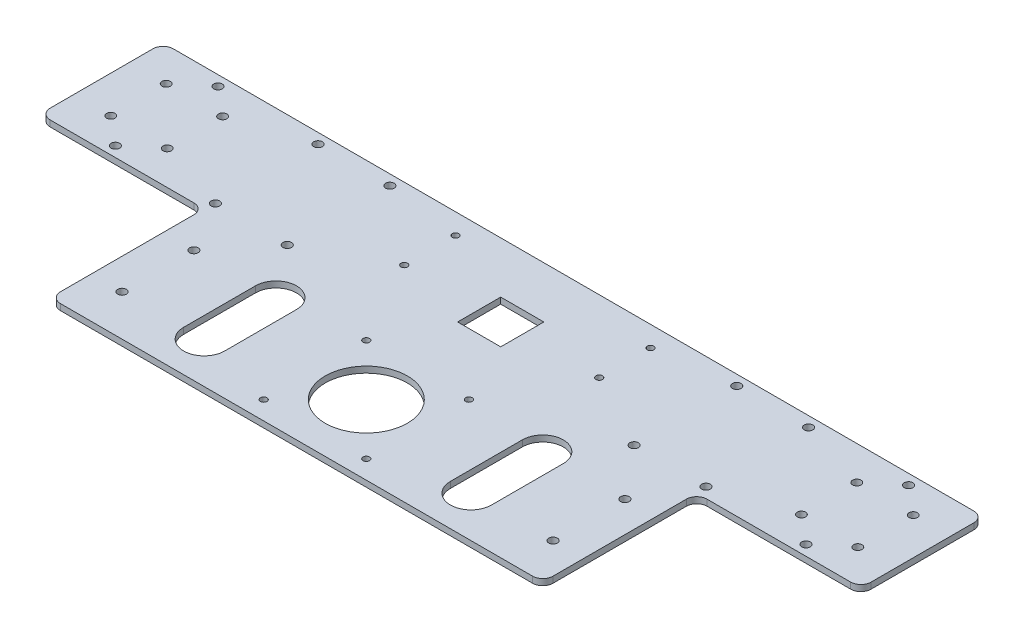
from build123d import *

# Parameters (mm, degrees)
SKETCH_1_W          = 400
SKETCH_1_H          = 60
SKETCH_1_R          = 1.6
SKETCH_1_W_2        = 21
SKETCH_1_H_2        = 21
SKETCH_1_W_3        = 240
SKETCH_1_H_3        = 75
SKETCH_1_R_2        = 20
EXTRUDE_1466_DEPTH  = 3
SKETCH_2_R          = 2.05
SKETCH_2_R_2        = 2.1
CUT_EXTRUDE_1_DEPTH = 250.229009796
FILLET_1_R          = 5
SKETCH1_R           = 2.1
CUT_EXTRUDE4_DEPTH  = 250.229009796


with BuildPart() as part:
    # 草图1 → Extrude 1466 (new body)
    # profile 1 of 2: a face of its own
    with BuildSketch(Plane(origin=(0, 0, 0), x_dir=(1, 0, 0), z_dir=(0, 1, 0))):
        with Locations((32.825924772, 16.128249268)):
            Rectangle(SKETCH_1_W, SKETCH_1_H)
        with Locations(Location((-14.674075228, 36.128249268, 0), (0, 0, 270))):
            Circle(SKETCH_1_R, mode=Mode.SUBTRACT)
        with Locations(Location((-14.674075228, 11.128249268, 0), (0, 0, 270))):
            Circle(SKETCH_1_R, mode=Mode.SUBTRACT)
        with Locations(Location((80.325924772, 11.128249268, 0), (0, 0, 270))):
            Circle(SKETCH_1_R, mode=Mode.SUBTRACT)
        with Locations(Location((80.325924772, 36.128249268, 0), (0, 0, 270))):
            Circle(SKETCH_1_R, mode=Mode.SUBTRACT)
        with Locations((32.825924772, 10.628249268)):
            Rectangle(SKETCH_1_W_2, SKETCH_1_H_2, mode=Mode.SUBTRACT)
    # profile 2 of 2: a face of its own
    with BuildSketch(Plane(origin=(0, 0, 0), x_dir=(1, 0, 0), z_dir=(0, 1, 0))):
        with Locations((32.825924772, -51.371750732)):
            Rectangle(SKETCH_1_W_3, SKETCH_1_H_3)
        with Locations(Location((7.825924772, -29.871750732, 0), (0, 0, 270))):
            Circle(SKETCH_1_R, mode=Mode.SUBTRACT)
        with Locations(Location((7.825924772, -79.871750732, 0), (0, 0, 270))):
            Circle(SKETCH_1_R, mode=Mode.SUBTRACT)
        with Locations(Location((57.825924772, -79.871750732, 0), (0, 0, 270))):
            Circle(SKETCH_1_R, mode=Mode.SUBTRACT)
        with Locations(Location((57.825924772, -29.871750732, 0), (0, 0, 270))):
            Circle(SKETCH_1_R, mode=Mode.SUBTRACT)
        with Locations(Location((32.825924772, -54.871750732, 0), (0, 0, 270))):
            Circle(SKETCH_1_R_2, mode=Mode.SUBTRACT)
    extrude(amount=EXTRUDE_1466_DEPTH)

    # 草图2 → 切除-拉伸1 (cut, through all)
    with BuildSketch(Plane(origin=(0, 3, 0), x_dir=(1, 0, 0), z_dir=(0, 1, 0))):
        with Locations(Location((-149.174075228, 29.628249268, 0), (0, 0, 270))):
            Circle(SKETCH_2_R)
        with Locations(Location((-149.174075228, 2.628249268, 0), (0, 0, 270))):
            Circle(SKETCH_2_R)
        with Locations(Location((-121.674075228, 29.628249268, 0), (0, 0, 270))):
            Circle(SKETCH_2_R)
        with Locations(Location((-121.674075228, 2.628249268, 0), (0, 0, 90))):
            Circle(SKETCH_2_R)
        with Locations(Location((-51.674075228, 41.128249268, 0), (0, 0, 270))):
            Circle(SKETCH_2_R_2)
        with Locations(Location((-86.674075228, 41.128249268, 0), (0, 0, 270))):
            Circle(SKETCH_2_R_2)
        with Locations(Location((-51.674075228, -8.871750732, 0), (0, 0, 90))):
            Circle(SKETCH_2_R_2)
        with Locations(Location((-86.674075228, -8.871750732, 0), (0, 0, 90))):
            Circle(SKETCH_2_R_2)
        with Locations(Location((-135.424075228, 41.128249268, 0), (0, 0, 270))):
            Circle(SKETCH_2_R_2)
        with Locations(Location((-135.424075228, -8.871750732, 0), (0, 0, 90))):
            Circle(SKETCH_2_R_2)
        with Locations(Location((201.075924772, -8.871750732, 0), (0, 0, 270))):
            Circle(SKETCH_2_R_2)
        with Locations(Location((201.075924772, 41.128249268, 0), (0, 0, 90))):
            Circle(SKETCH_2_R_2)
        with Locations(Location((152.325924772, -8.871750732, 0), (0, 0, 270))):
            Circle(SKETCH_2_R_2)
        with Locations(Location((117.325924772, -8.871750732, 0), (0, 0, 270))):
            Circle(SKETCH_2_R_2)
        with Locations(Location((152.325924772, 41.128249268, 0), (0, 0, 90))):
            Circle(SKETCH_2_R_2)
        with Locations(Location((117.325924772, 41.128249268, 0), (0, 0, 90))):
            Circle(SKETCH_2_R_2)
        with Locations(Location((187.325924772, 2.628249268, 0), (0, 0, 270))):
            Circle(SKETCH_2_R)
        with Locations(Location((187.325924772, 29.628249268, 0), (0, 0, 90))):
            Circle(SKETCH_2_R)
        with Locations(Location((214.825924772, 2.628249268, 0), (0, 0, 90))):
            Circle(SKETCH_2_R)
        with Locations(Location((214.825924772, 29.628249268, 0), (0, 0, 90))):
            Circle(SKETCH_2_R)
    extrude(amount=-CUT_EXTRUDE_1_DEPTH, mode=Mode.SUBTRACT)

    # 圆角1
    fillet_1_edges = [part.edges().sort_by_distance(p)[0] for p in [
        (-167.174075228, 1.5, 13.871750732),
        (-167.174075228, 1.5, -46.128249268),
        (232.825924772, 1.5, -46.128249268),
        (232.825924772, 1.5, 13.871750732),
        (152.825924772, 1.5, 13.871750732),
        (152.825924772, 1.5, 88.871750732),
        (-87.174075228, 1.5, 88.871750732),
        (-87.174075228, 1.5, 13.871750732),
    ]]
    fillet(fillet_1_edges, radius=FILLET_1_R)

    # Sketch1 → Cut-Extrude4 (cut, through all)
    with BuildSketch(Plane(origin=(0, 0, 0), x_dir=(1, 0, 0), z_dir=(0, 1, 0))):
        with Locations(Location((-72.174075228, -33.871750732, 0), (0, 0, 270))):
            Circle(SKETCH1_R)
        with Locations(Location((-72.174075228, -68.871750732, 0), (0, 0, 270))):
            Circle(SKETCH1_R)
        with Locations(Location((137.825924772, -68.871750732, 0), (0, 0, 90))):
            Circle(SKETCH1_R)
        with Locations(Location((137.825924772, -33.871750732, 0), (0, 0, 90))):
            Circle(SKETCH1_R)
        with BuildLine():
            Line((-42.174075228, -68.871750732), (-42.174075228, -33.871750732))
            ThreePointArc((-42.174075228, -33.871750732), (-32.174075228, -23.871750732), (-22.174075228, -33.871750732))
            Line((-22.174075228, -33.871750732), (-22.174075228, -68.871750732))
            ThreePointArc((-22.174075228, -68.871750732), (-32.174075228, -78.871750732), (-42.174075228, -68.871750732))
        make_face()
        with BuildLine():
            Line((107.825924772, -68.871750732), (107.825924772, -33.871750732))
            ThreePointArc((107.825924772, -33.871750732), (97.825924772, -23.871750732), (87.825924772, -33.871750732))
            Line((87.825924772, -33.871750732), (87.825924772, -68.871750732))
            ThreePointArc((87.825924772, -68.871750732), (97.825924772, -78.871750732), (107.825924772, -68.871750732))
        make_face()
    extrude(amount=CUT_EXTRUDE4_DEPTH, mode=Mode.SUBTRACT)


solid = part.part
